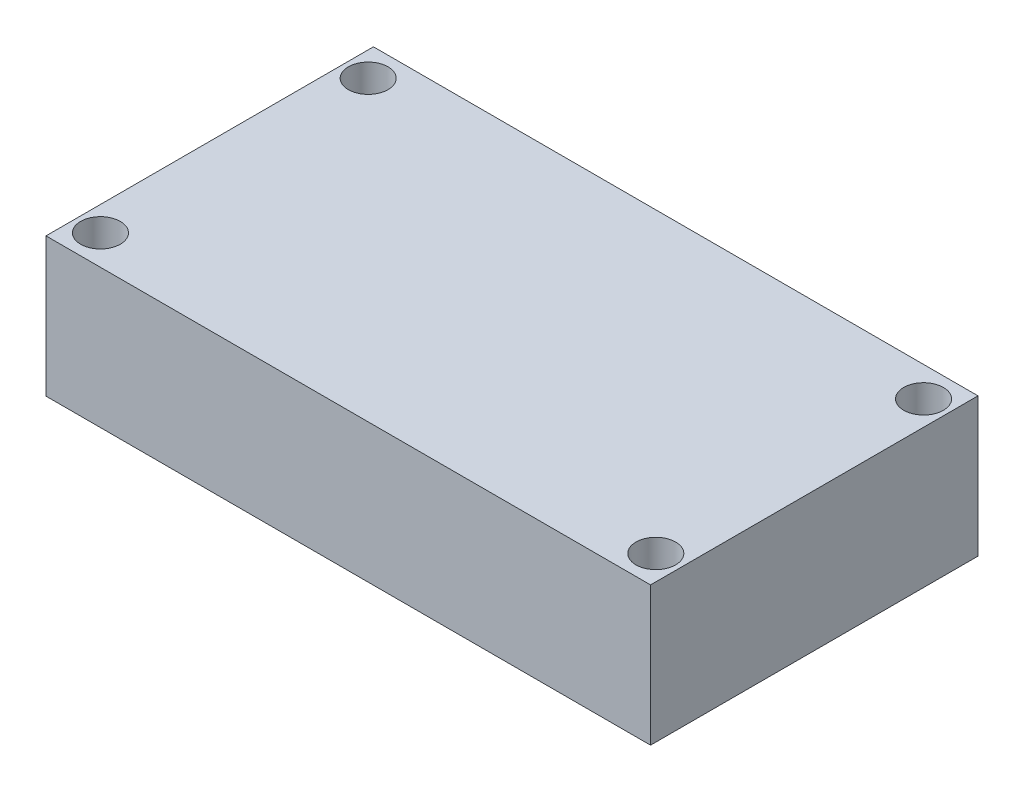
from build123d import *

# Parameters (mm, degrees)
ESQUISSE1_W             = 60.96
ESQUISSE1_H             = 33.02
BOSS_EXTRU_1_DEPTH      = 14
ENL_V_MAT_EXTRU_1_REACH = 39.385
ESQUISSE2_R             = 2


with BuildPart() as part:
    # Esquisse1 → Boss.-Extru.1 (new body)
    with BuildSketch(Plane(origin=(0, 0, 0), x_dir=(1, 0, 0), z_dir=(0, 1, 0))):
        Rectangle(ESQUISSE1_W, ESQUISSE1_H)
    extrude(amount=BOSS_EXTRU_1_DEPTH)

    # Esquisse2 → Enlèv. mat.-Extru.1 (cut, up to next)
    with BuildSketch(Plane(origin=(0, 14, 0), x_dir=(1, 0, 0), z_dir=(0, 1, 0)), mode=Mode.PRIVATE) as enl_v_mat_extru_1_sk1:
        with Locations(Location((-28, 13.5, 0), (0, 0, 270))):
            Circle(ESQUISSE2_R)
    enl_v_mat_extru_1_tool1 = extrude(enl_v_mat_extru_1_sk1.sketch, amount=-ENL_V_MAT_EXTRU_1_REACH, mode=Mode.PRIVATE) & part.part
    # Esquisse2 → Enlèv. mat.-Extru.1 (cut, up to next)
    with BuildSketch(Plane(origin=(0, 14, 0), x_dir=(1, 0, 0), z_dir=(0, 1, 0)), mode=Mode.PRIVATE) as enl_v_mat_extru_1_sk2:
        with Locations(Location((28, 13.5, 0), (0, 0, 270))):
            Circle(ESQUISSE2_R)
    enl_v_mat_extru_1_tool2 = extrude(enl_v_mat_extru_1_sk2.sketch, amount=-ENL_V_MAT_EXTRU_1_REACH, mode=Mode.PRIVATE) & part.part
    # Esquisse2 → Enlèv. mat.-Extru.1 (cut, up to next)
    with BuildSketch(Plane(origin=(0, 14, 0), x_dir=(1, 0, 0), z_dir=(0, 1, 0)), mode=Mode.PRIVATE) as enl_v_mat_extru_1_sk3:
        with Locations(Location((28, -13.5, 0), (0, 0, 270))):
            Circle(ESQUISSE2_R)
    enl_v_mat_extru_1_tool3 = extrude(enl_v_mat_extru_1_sk3.sketch, amount=-ENL_V_MAT_EXTRU_1_REACH, mode=Mode.PRIVATE) & part.part
    # Esquisse2 → Enlèv. mat.-Extru.1 (cut, up to next)
    with BuildSketch(Plane(origin=(0, 14, 0), x_dir=(1, 0, 0), z_dir=(0, 1, 0)), mode=Mode.PRIVATE) as enl_v_mat_extru_1_sk4:
        with Locations(Location((-28, -13.5, 0), (0, 0, 270))):
            Circle(ESQUISSE2_R)
    enl_v_mat_extru_1_tool4 = extrude(enl_v_mat_extru_1_sk4.sketch, amount=-ENL_V_MAT_EXTRU_1_REACH, mode=Mode.PRIVATE) & part.part
    add(enl_v_mat_extru_1_tool1.solids().sort_by_distance((-28, 14, -13.5))[0], mode=Mode.SUBTRACT)
    add(enl_v_mat_extru_1_tool2.solids().sort_by_distance((28, 14, -13.5))[0], mode=Mode.SUBTRACT)
    add(enl_v_mat_extru_1_tool3.solids().sort_by_distance((28, 14, 13.5))[0], mode=Mode.SUBTRACT)
    add(enl_v_mat_extru_1_tool4.solids().sort_by_distance((-28, 14, 13.5))[0], mode=Mode.SUBTRACT)


solid = part.part
